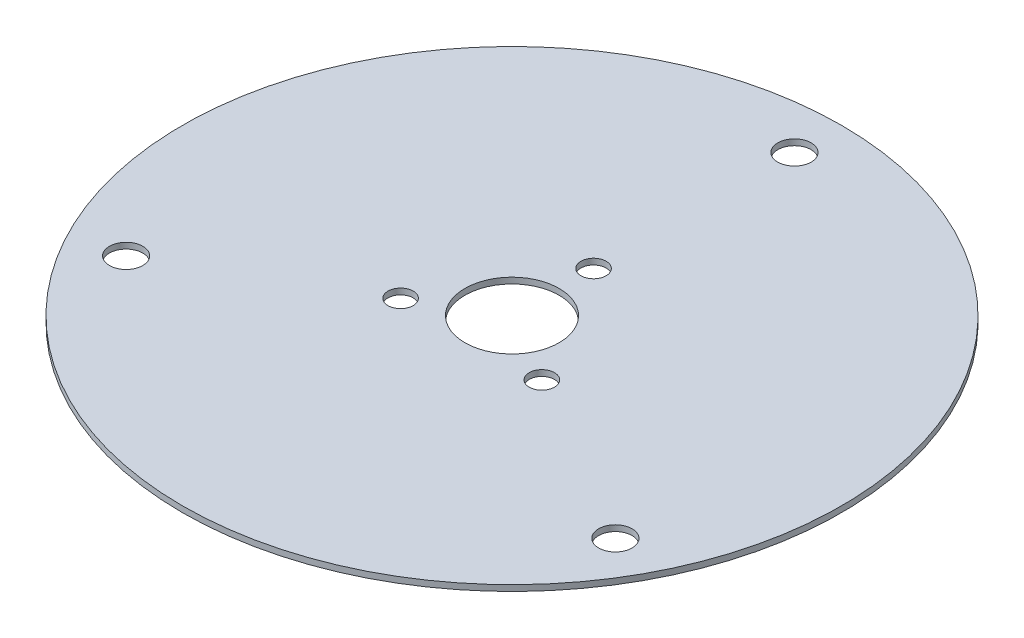
from build123d import *

# Parameters (mm, degrees)
SKETCH1_R            = 44.45
BOSS_EXTRUDE1_DEPTH  = 0.8
M4_CLEARANCE_HOLE1_D = 4.5
SKETCH11_R           = 6.35
CUT_EXTRUDE1_DEPTH   = 63.866883174
M3_CLEARANCE_HOLE1_D = 3.4


with BuildPart() as part:
    # Sketch1 → Boss-Extrude1 (new body)
    with BuildSketch(Plane(origin=(0, 0, 0), x_dir=(1, 0, 0), z_dir=(0, 1, 0))):
        with Locations(Location((0, 0, 0), (0, 0, 270))):
            Circle(SKETCH1_R)
    extrude(amount=BOSS_EXTRUDE1_DEPTH)

    # M4 Clearance Hole1 (through all)
    with Locations(Plane(origin=(0, 0.8, 0), x_dir=(1, 0, 0), z_dir=(0, 1, 0))):
        with Locations((0, 38.1), (-32.995567884, -19.05), (32.995567884, -19.05)):
            Hole(M4_CLEARANCE_HOLE1_D / 2)

    # Sketch11 → Cut-Extrude1 (cut, through all)
    with BuildSketch(Plane(origin=(0, 0.8, 0), x_dir=(1, 0, 0), z_dir=(0, 1, 0))):
        with Locations(Location((0, 0, 0), (0, 0, 270))):
            Circle(SKETCH11_R)
    extrude(amount=-CUT_EXTRUDE1_DEPTH, mode=Mode.SUBTRACT)

    # M3 Clearance Hole1 (through all)
    with Locations(Plane(origin=(0, 0.8, 0), x_dir=(1, 0, 0), z_dir=(0, 1, 0))):
        with Locations((0, 11), (-9.526279442, -5.5), (9.526279442, -5.5)):
            Hole(M3_CLEARANCE_HOLE1_D / 2)


solid = part.part
